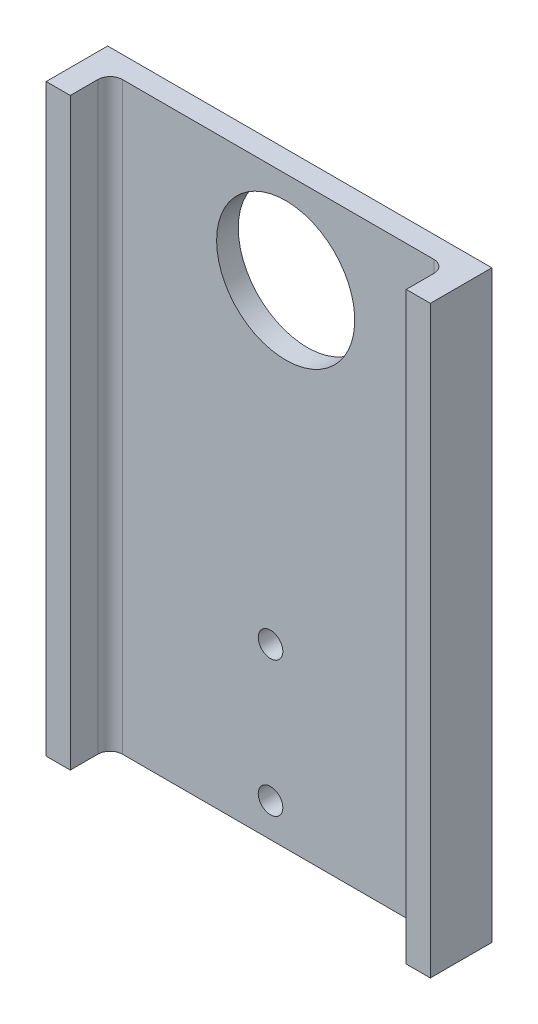
from build123d import *

# Parameters (mm, degrees)
BOSS_EXTRUDE1_DEPTH = 120.65
SKETCH3_R           = 14.2621
CUT_EXTRUDE1_DEPTH  = 107.95
SKETCH4_R           = 2.54
CUT_EXTRUDE2_DEPTH  = 127
SKETCH5_R           = 2.54
CUT_EXTRUDE3_DEPTH  = 127
FILLET1_R           = 2.54
FILLET2_R           = 2.54


with BuildPart() as part:
    # Sketch2 → Boss-Extrude1 (new body)
    with BuildSketch(Plane(origin=(0, 0, 0), x_dir=(1, 0, 0), z_dir=(0, 1, 0))):
        Polygon((0, 0), (41.226518858, 0), (41.226518858, -12.7), (36.248118858, -12.7), (36.248118858, -4.4704), (0, -4.4704), (-33.1216, -4.4704), (-33.1216, -12.7), (-38.1, -12.7), (-38.1, 0), align=None)
    extrude(amount=BOSS_EXTRUDE1_DEPTH)

    # Sketch3 → Cut-Extrude1 (cut)
    with BuildSketch(Plane(origin=(0, 0, 0), x_dir=(-1, 0, 0), z_dir=(0, 0, -1))):
        with Locations((-3.126518858, 101.6)):
            Circle(SKETCH3_R)
    extrude(amount=-CUT_EXTRUDE1_DEPTH, mode=Mode.SUBTRACT)

    # Sketch4 → Cut-Extrude2 (cut)
    with BuildSketch(Plane(origin=(0, 0, 0), x_dir=(-1, 0, 0), z_dir=(0, 0, -1))):
        with Locations((0, 34.925)):
            Circle(SKETCH4_R)
    extrude(amount=-CUT_EXTRUDE2_DEPTH, mode=Mode.SUBTRACT)

    # Sketch5 → Cut-Extrude3 (cut)
    with BuildSketch(Plane(origin=(0, 0, 0), x_dir=(-1, 0, 0), z_dir=(0, 0, -1))):
        with Locations((0, 6.985)):
            Circle(SKETCH5_R)
    extrude(amount=-CUT_EXTRUDE3_DEPTH, mode=Mode.SUBTRACT)

    # Fillet1
    fillet1_edges = [part.edges().sort_by_distance(p)[0] for p in [
        (-33.1216, 60.325, 4.4704),
    ]]
    fillet(fillet1_edges, radius=FILLET1_R)

    # Fillet2
    fillet2_edges = [part.edges().sort_by_distance(p)[0] for p in [
        (36.248118858, 60.325, 4.4704),
    ]]
    fillet(fillet2_edges, radius=FILLET2_R)


solid = part.part
